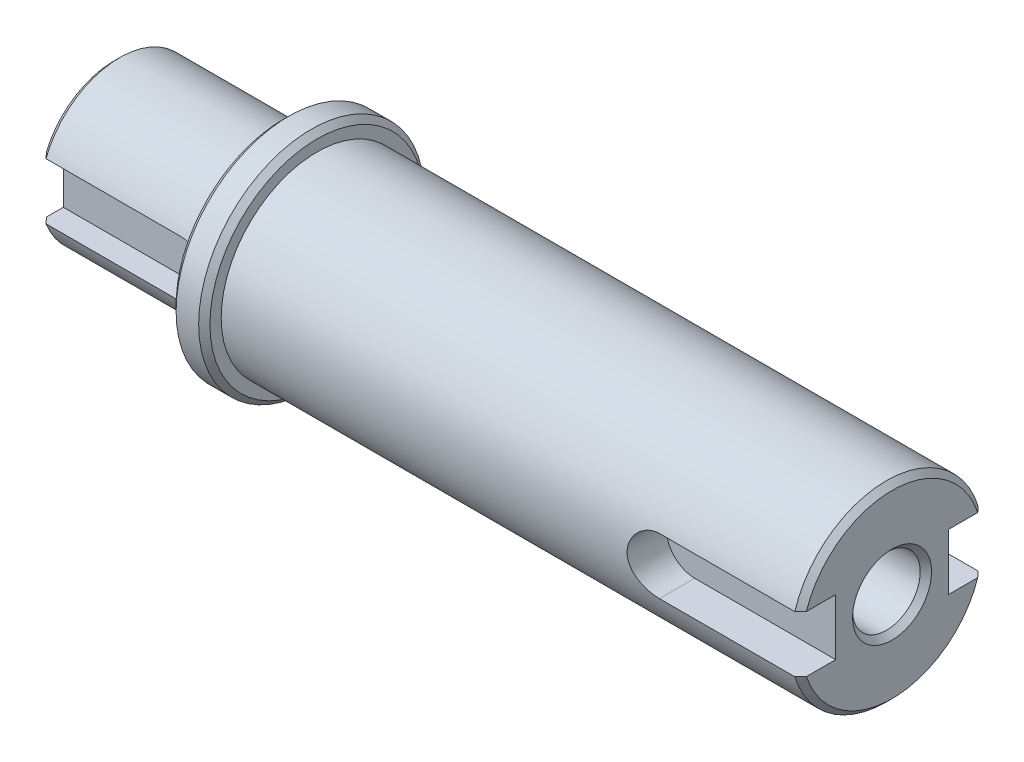
from build123d import *

# Parameters (mm, degrees)
CHAMFER_1_SIZE               = 0.5
HOLE_WIZARD_M6_1_D           = 6
HOLE_WIZARD_M6_1_DEPTH       = 15
HOLE_WIZARD_M6_1_CSINK_D     = 7
HOLE_WIZARD_M6_1_CSINK_ANGLE = 90
HOLE_WIZARD_M6_1_TIP         = 1.802581857
CUT_EXTRUDE_START            = 4.5
CUT_EXTRUDE_1_DEPTH          = 10
CUT_EXTRUDE_START_2          = 5
CUT_EXTRUDE_2_DEPTH          = 10
PATTERN_CIRCULAR_1_COUNT     = 2


with BuildPart() as part:
    # 草图1 → 旋转1 (revolve)
    with BuildSketch(Plane.XY, mode=Mode.PRIVATE) as revolve_1_sk:
        Polygon((0, 0), (0, 7), (15, 7), (15, 10), (18, 10), (18, 8.5), (69, 8.5), (69, 0), align=None)
    revolve(revolve_1_sk.sketch.rotate(Axis((0, 0, 0), (1, 0, 0)), 90), axis=Axis((0, 0, 0), (1, 0, 0)))

    # 倒角1
    chamfer_1_edges = [part.edges().sort_by_distance(p)[0] for p in [
        (69, 0, -8.5),
        (18, 0, -10),
        (15, 0, -10),
        (0, 0, -7),
    ]]
    chamfer(chamfer_1_edges, length=CHAMFER_1_SIZE)

    # M6 螺纹孔的螺纹孔钻头1
    with Locations(Plane(origin=(69, 0, 0), x_dir=(0, 0, -1), z_dir=(1, 0, 0))):
        with Locations((0, 0)):
            CounterSinkHole(HOLE_WIZARD_M6_1_D / 2, HOLE_WIZARD_M6_1_CSINK_D / 2, depth=HOLE_WIZARD_M6_1_DEPTH, counter_sink_angle=HOLE_WIZARD_M6_1_CSINK_ANGLE)
            with Locations((0, 0, -(HOLE_WIZARD_M6_1_DEPTH + HOLE_WIZARD_M6_1_TIP / 2))):  # 118° drill point
                Cone(0, HOLE_WIZARD_M6_1_D / 2, HOLE_WIZARD_M6_1_TIP, mode=Mode.SUBTRACT)

    # 草图4 → 切除-拉伸1 (cut)
    with BuildSketch(Plane.XY.offset(CUT_EXTRUDE_START)):
        with BuildLine():
            Line((0, 2.5), (12.5, 2.5))
            ThreePointArc((12.5, 2.5), (15, 0), (12.5, -2.5))
            Line((12.5, -2.5), (0, -2.5))
            Line((0, -2.5), (0, 2.5))
        make_face()
    extrude(amount=CUT_EXTRUDE_1_DEPTH, mode=Mode.SUBTRACT)

    # 草图5 → 切除-拉伸2 (cut)
    with BuildSketch(Plane.XY.offset(CUT_EXTRUDE_START_2)):
        with BuildLine():
            Line((69, 2.5), (56.5, 2.5))
            ThreePointArc((56.5, 2.5), (54, 0), (56.5, -2.5))
            Line((56.5, -2.5), (69, -2.5))
            Line((69, -2.5), (69, 2.5))
        make_face()
    cut_extrude_2 = extrude(amount=CUT_EXTRUDE_2_DEPTH, mode=Mode.SUBTRACT)

    # 阵列(圆周)1: 切除-拉伸2 ×2 about axis
    pattern_circular_1_axis = Axis((0, 0, 0), (1, 0, 0))
    for i in range(1, PATTERN_CIRCULAR_1_COUNT):
        add(cut_extrude_2.rotate(pattern_circular_1_axis, i * 360 / PATTERN_CIRCULAR_1_COUNT), mode=Mode.SUBTRACT)


solid = part.part
